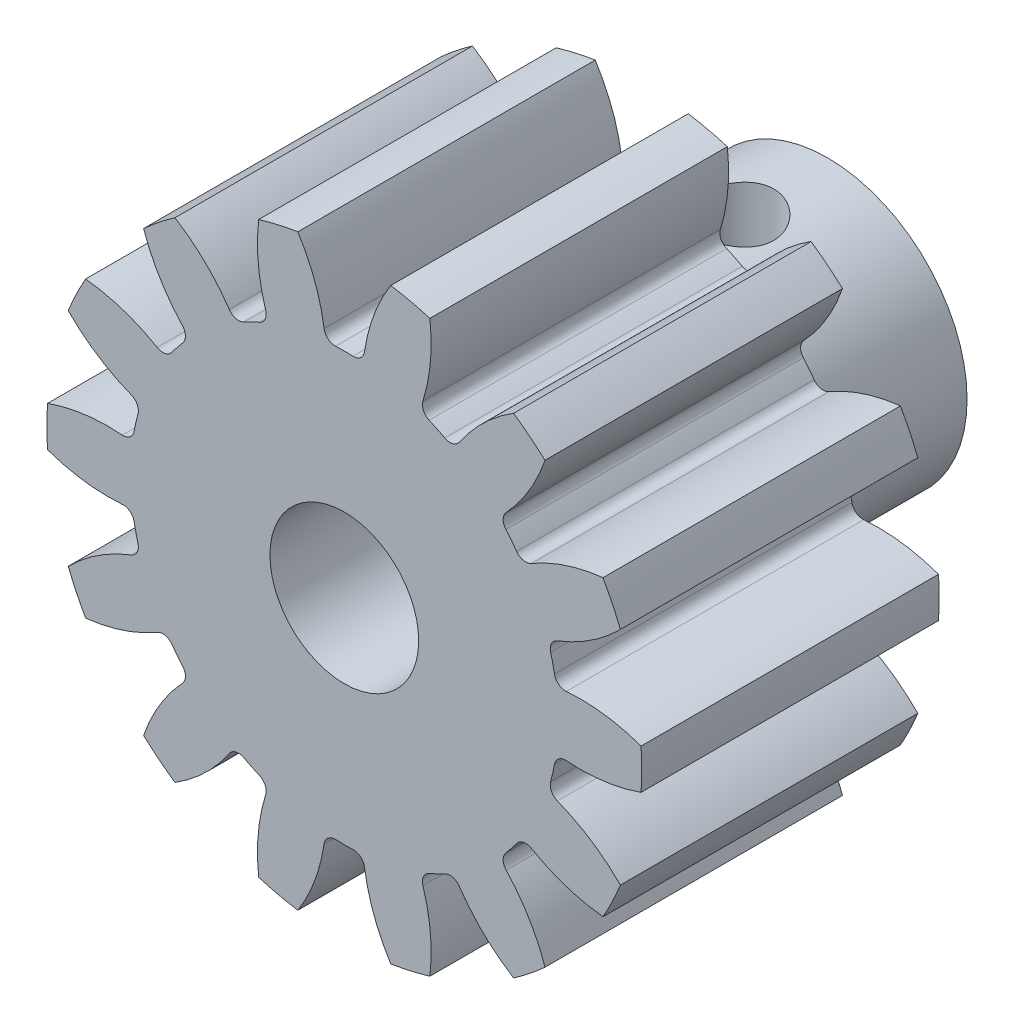
from build123d import *

# Parameters (mm, degrees)
IZIM1_R                        = 16
Y_KSEKLIK_EKSTR_ZYON1_DEPTH    = 8
KES_EKSTR_ZYON1_DEPTH          = 16
RADYUS1_R                      = 0.6
DAIRESEL_KAPLAMA1_COUNT        = 14
RADYUS1_OF_DAIRESEL_KAPLAMA1_R = 0.6
SKETCH1_R                      = 4
CUT_EXTRUDE1_DEPTH             = 26
BOSS_EXTRUDE1_START            = 10
SKETCH2_R                      = 7.5
SKETCH2_R_2                    = 4
BOSS_EXTRUDE1_DEPTH            = 10
CUT_EXTRUDE2_DEPTH             = 29.805394861
CUT_EXTRUDE2_DEPTH_BACK        = 29.805394861
SKETCH3_R                      = 2.1


with BuildPart() as part:
    # Çizim1 → Yükseklik-Ekstrüzyon1 (new, symmetric)
    with BuildSketch(Plane.XY):
        Circle(IZIM1_R)
    extrude(amount=Y_KSEKLIK_EKSTR_ZYON1_DEPTH, both=True)

    # Çizim2 → Kes-Ekstrüzyon1 (cut)
    with BuildSketch(Plane.XY.offset(8)):
        with BuildLine():
            ThreePointArc((-3.149616474, 16.705685142), (-1.693274117, 14.239025291), (-1.020653849, 11.454617659))
            ThreePointArc((-1.020653849, 11.454617659), (0, 11.5), (1.020653849, 11.454617659))
            ThreePointArc((1.020653849, 11.454617659), (1.693274117, 14.239025291), (3.149616474, 16.705685142))
            ThreePointArc((3.149616474, 16.705685142), (0, 17), (-3.149616474, 16.705685142))
        make_face()
    kes_ekstr_zyon1 = extrude(amount=-KES_EKSTR_ZYON1_DEPTH, mode=Mode.SUBTRACT)

    # Radyus1
    radyus1_edges = [part.edges().sort_by_distance(p)[0] for p in [
        (-1.020653849, 11.454617659, 0),
        (1.020653849, 11.454617659, 0),
    ]]
    fillet(radyus1_edges, radius=RADYUS1_R)

    # Dairesel Kaplama1: Kes-Ekstrüzyon1 ×14 about axis
    dairesel_kaplama1_axis = Axis((0, 0, 0), (0, 0, 1))
    for i in range(1, DAIRESEL_KAPLAMA1_COUNT):
        add(kes_ekstr_zyon1.rotate(dairesel_kaplama1_axis, i * 360 / DAIRESEL_KAPLAMA1_COUNT), mode=Mode.SUBTRACT)

    # Radyus1 of Dairesel Kaplama1
    radyus1_of_dairesel_kaplama1_edges = [part.edges().sort_by_distance(p)[0] for p in [
        (-5.889549683, 9.877408796, 0),
        (-4.050394997, 10.763099013, 0),
        (-9.591947972, 6.343857983, 0),
        (-8.319213439, 7.939816607, 0),
        (-11.394543327, 1.553828293, 0),
        (-10.940309632, 3.543956146, 0),
        (-10.940309632, -3.543956146, 0),
        (-11.394543327, -1.553828293, 0),
        (-8.319213439, -7.939816607, 0),
        (-9.591947972, -6.343857983, 0),
        (-4.050394997, -10.763099013, 0),
        (-5.889549683, -9.877408796, 0),
        (1.020653849, -11.454617659, 0),
        (-1.020653849, -11.454617659, 0),
        (5.889549683, -9.877408796, 0),
        (4.050394997, -10.763099013, 0),
        (9.591947972, -6.343857983, 0),
        (8.319213439, -7.939816607, 0),
        (11.394543327, -1.553828293, 0),
        (10.940309632, -3.543956146, 0),
        (10.940309632, 3.543956146, 0),
        (11.394543327, 1.553828293, 0),
        (8.319213439, 7.939816607, 0),
        (9.591947972, 6.343857983, 0),
        (4.050394997, 10.763099013, 0),
        (5.889549683, 9.877408796, 0),
    ]]
    fillet(radyus1_of_dairesel_kaplama1_edges, radius=RADYUS1_OF_DAIRESEL_KAPLAMA1_R)

    # Sketch1 → Cut-Extrude1 (cut)
    with BuildSketch(Plane(origin=(0, 0, -8), x_dir=(-1, 0, 0), z_dir=(0, 0, -1))):
        Circle(SKETCH1_R)
    extrude(amount=-CUT_EXTRUDE1_DEPTH, mode=Mode.SUBTRACT)

    # Sketch2 → Boss-Extrude1 (add)
    with BuildSketch(Plane(origin=(0, 0, -8), x_dir=(-1, 0, 0), z_dir=(0, 0, -1)).offset(BOSS_EXTRUDE1_START)):
        with Locations(Location((0, 0, 0), (0, 0, 180))):
            Circle(SKETCH2_R)
        Circle(SKETCH2_R_2, mode=Mode.SUBTRACT)
    extrude(amount=-BOSS_EXTRUDE1_DEPTH)

    # Sketch3 → Cut-Extrude2 (cut, two sides: drawn at the far end of the back side and taken through both)
    with BuildSketch(Plane(origin=(0, 0, 0), x_dir=(1, 0, 0), z_dir=(0, 1, 0)).offset(-CUT_EXTRUDE2_DEPTH_BACK)):
        with Locations(Location((0, 13, 0), (0, 0, 270))):
            Circle(SKETCH3_R)
    extrude(amount=CUT_EXTRUDE2_DEPTH + CUT_EXTRUDE2_DEPTH_BACK, mode=Mode.SUBTRACT)


solid = part.part
